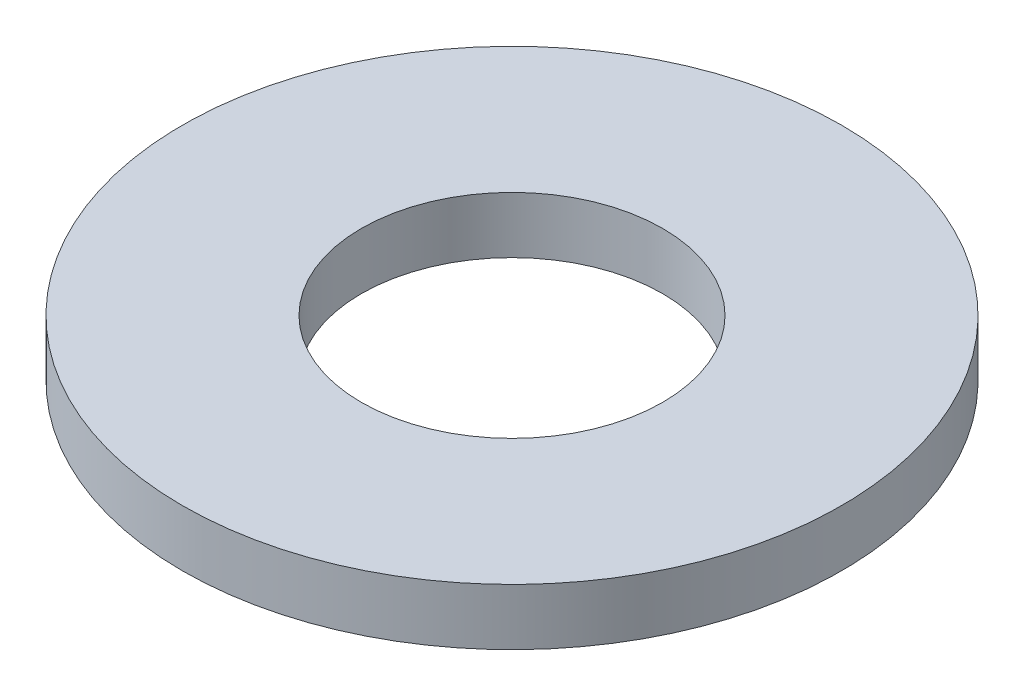
from build123d import *

# Parameters (mm, degrees)
ESQUISSE1_W = 3.8
ESQUISSE1_H = 1.2


with BuildPart() as part:
    # Esquisse1 → Base (revolve)
    with BuildSketch(Plane.XY):
        with Locations((5.1, 0.6)):
            Rectangle(ESQUISSE1_W, ESQUISSE1_H)
    revolve(axis=Axis((0, 0, 0), (0, 1, 0)))


solid = part.part
